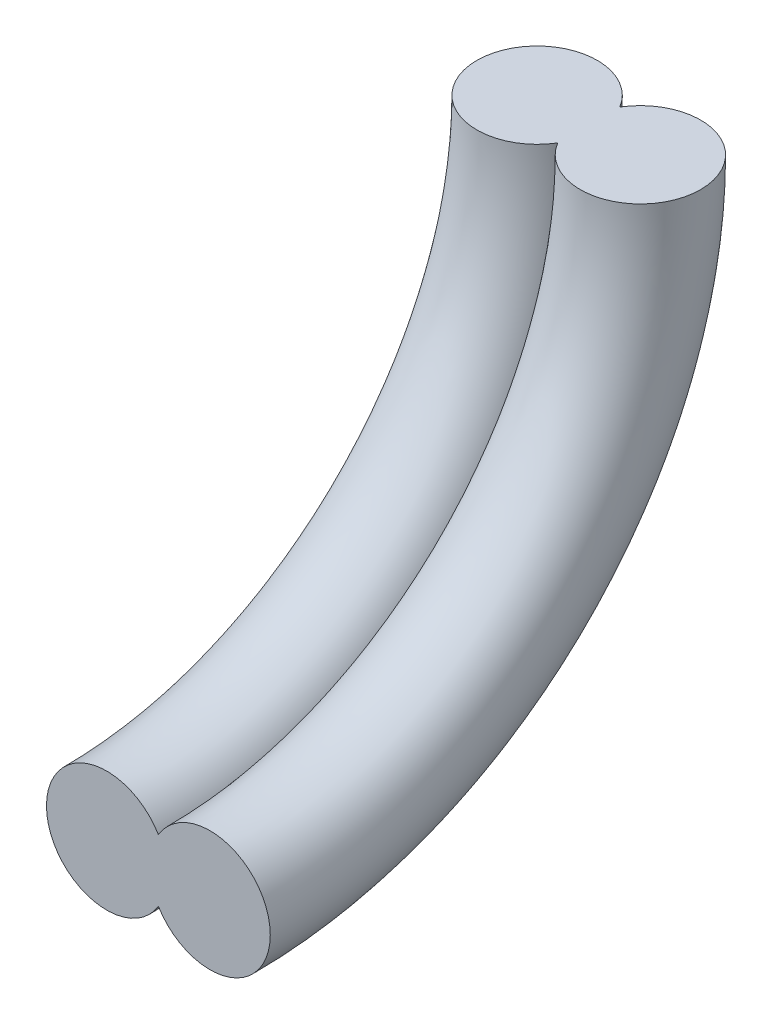
from build123d import *

# Parameters (mm, degrees)
SKETCH1_R = 0.889


with BuildPart() as part:
    # Sweep2: sweep along a path in Sketch3
    with BuildLine(Plane(origin=(0.2794, 0, 0), x_dir=(0, 0, -1), z_dir=(1, 0, 0))) as sweep2_path:
        ThreePointArc((0, 0), (-1.859871939, -4.490128061), (-6.35, -6.35))
    # Sketch1 → Sweep2 (sweep)
    with BuildSketch(Plane(origin=(0, 0, 0), x_dir=(1, 0, 0), z_dir=(0, 1, 0))):
        with Locations((0.762, 0)):
            Circle(SKETCH1_R)
    sweep2 = sweep(path=sweep2_path.line)

    # Mirror4: Sweep2 across plane
    add(sweep2.mirror(Plane(origin=(0, 0, 0), x_dir=(0, 0, 1), z_dir=(1, 0, 0))))


solid = part.part
